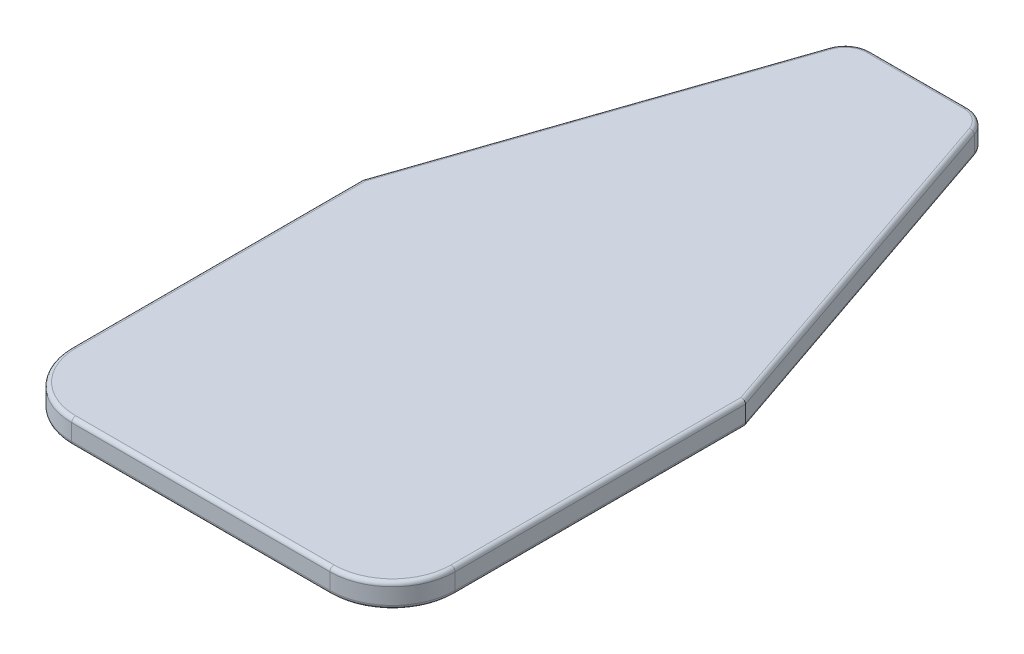
from build123d import *

# Parameters (mm, degrees)
BOSS_EXTRUDE1_DEPTH = 19.05
FILLET1_R           = 3.175
FILLET2_R           = 3.175


with BuildPart() as part:
    # Sketch1 → Boss-Extrude1 (new body)
    with BuildSketch(Plane(origin=(0, 0, 0), x_dir=(1, 0, 0), z_dir=(0, 1, 0))):
        with BuildLine():
            Line((-101.6, -24.364478091), (101.6, -24.364478091))
            ThreePointArc((101.6, -24.364478091), (136.398492469, -9.95047056), (150.8125, 24.848021909))
            Line((150.8125, 24.848021909), (150.8125, 253.448021909))
            Line((150.8125, 253.448021909), (57.15, 527.169679348))
            ThreePointArc((57.15, 527.169679348), (49.807835716, 537.031618051), (38.1, 540.785521909))
            Line((38.1, 540.785521909), (-38.1, 540.785521909))
            ThreePointArc((-38.1, 540.785521909), (-49.807835716, 537.031618051), (-57.15, 527.169679348))
            Line((-57.15, 527.169679348), (-150.8125, 253.448021909))
            Line((-150.8125, 253.448021909), (-150.8125, 24.848021909))
            ThreePointArc((-150.8125, 24.848021909), (-136.398492469, -9.95047056), (-101.6, -24.364478091))
        make_face()
    extrude(amount=BOSS_EXTRUDE1_DEPTH)

    # Fillet1
    fillet1_edges = [part.edges().sort_by_distance(p)[0] for p in [
        (136.398492469, 19.05, 9.95047056),
        (150.8125, 19.05, -139.148021909),
        (103.98125, 19.05, -390.308850629),
        (49.807835716, 19.05, -537.031618051),
        (0, 19.05, -540.785521909),
        (-49.807835716, 19.05, -537.031618051),
        (-103.98125, 19.05, -390.308850629),
        (-150.8125, 19.05, -139.148021909),
        (-136.398492469, 19.05, 9.95047056),
        (0, 19.05, 24.364478091),
    ]]
    fillet(fillet1_edges, radius=FILLET1_R)

    # Fillet2
    fillet2_edges = [part.edges().sort_by_distance(p)[0] for p in [
        (-49.807835716, 0, -537.031618051),
        (0, 0, -540.785521909),
        (49.807835716, 0, -537.031618051),
        (103.98125, 0, -390.308850629),
        (150.8125, 0, -139.148021909),
        (136.398492469, 0, 9.95047056),
        (0, 0, 24.364478091),
        (-136.398492469, 0, 9.95047056),
        (-150.8125, 0, -139.148021909),
        (-103.98125, 0, -390.308850629),
    ]]
    fillet(fillet2_edges, radius=FILLET2_R)


solid = part.part
